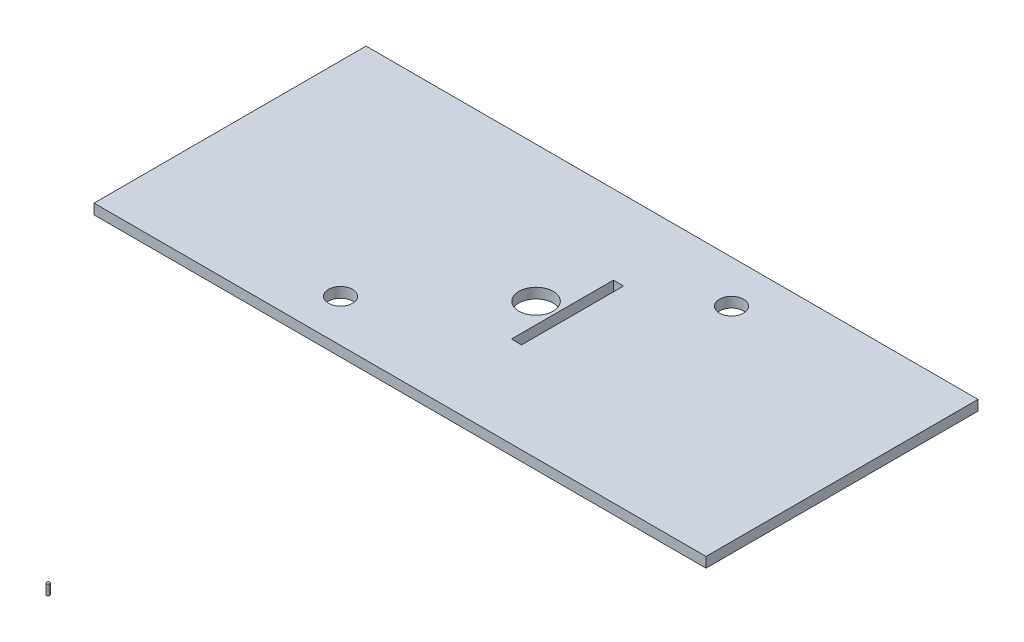
from build123d import *

# Parameters (mm, degrees)
ESBO_O1_R                  = 0.45
RESSALTO_EXTRUS_O1_DEPTH   = 3
ESBO_O1_W                  = 180
ESBO_O1_H                  = 80
ESBO_O1_R_2                = 5.05
RESSALTO_EXTRUS_O1_2_DEPTH = 3
ESBO_O3_R                  = 3.55
CORTE_EXTRUS_O2_DEPTH      = 100
ESBO_O4_W                  = 3
ESBO_O4_H                  = 30
CORTE_EXTRUS_O3_DEPTH      = 10


with BuildPart() as part:
    # Esboço1 → Ressalto-extrusão1 (new body)
    with BuildSketch(Plane(origin=(0, 0, 0), x_dir=(1, 0, 0), z_dir=(0, 1, 0))):
        with Locations(Location((0, -143.5, 0), (0, 0, 270))):
            Circle(ESBO_O1_R)
    extrude(amount=RESSALTO_EXTRUS_O1_DEPTH)


with BuildPart() as body_2:
    # Esboço1 → Ressalto-extrus_o1 2 (new body)
    with BuildSketch(Plane(origin=(0, 0, 0), x_dir=(1, 0, 0), z_dir=(0, 1, 0))):
        Rectangle(ESBO_O1_W, ESBO_O1_H)
        with Locations(Location((0, 0, 0), (0, 0, 270))):
            Circle(ESBO_O1_R_2, mode=Mode.SUBTRACT)
    extrude(amount=RESSALTO_EXTRUS_O1_2_DEPTH)

    # Esboço3 → Corte-extrusão2 (cut)
    with BuildSketch(Plane(origin=(0, 3, 0), x_dir=(1, 0, 0), z_dir=(0, 1, 0))):
        with Locations(Location((30, 27.5, 0), (0, 0, 270))):
            Circle(ESBO_O3_R)
        with Locations(Location((-30, -27.5, 0), (0, 0, 270))):
            Circle(ESBO_O3_R)
    extrude(amount=-CORTE_EXTRUS_O2_DEPTH, mode=Mode.SUBTRACT)

    # Esboço4 → Corte-extrusão3 (cut)
    with BuildSketch(Plane(origin=(0, 3, 0), x_dir=(1, 0, 0), z_dir=(0, 1, 0))):
        with Locations((7.5, 1.748092336)):
            Rectangle(ESBO_O4_W, ESBO_O4_H)
    extrude(amount=-CORTE_EXTRUS_O3_DEPTH, mode=Mode.SUBTRACT)


solid = Compound([part.part, body_2.part])
